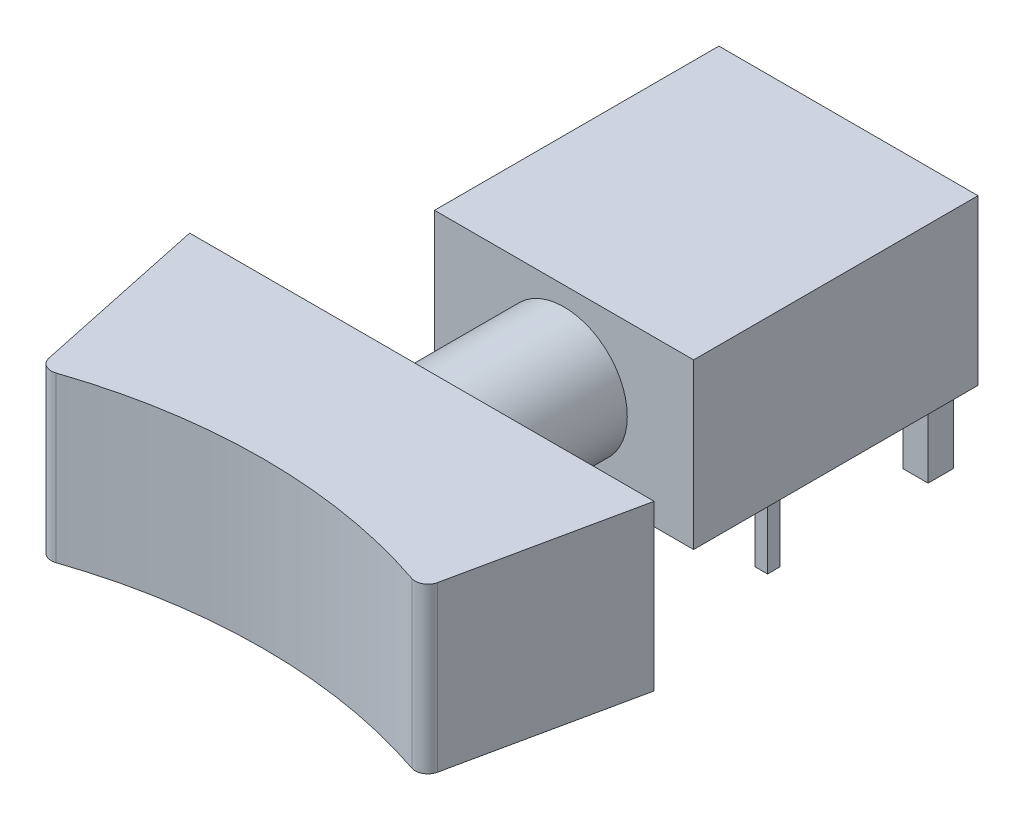
from build123d import *

# Parameters (mm, degrees)
SKETCH1_W           = 8.2
SKETCH1_H           = 9
BOSS_EXTRUDE1_DEPTH = 5.2
SKETCH2_W           = 0.4
SKETCH2_H           = 0.4
SKETCH2_W_2         = 0.8
SKETCH2_H_2         = 0.8
BOSS_EXTRUDE2_DEPTH = 3.3
CHAMFER1_SIZE       = 0.1
CHAMFER2_SIZE       = 0.25
SKETCH2_2_W         = 0.8
SKETCH2_2_H         = 0.38
BOSS_EXTRUDE3_DEPTH = 3
FILLET1_R           = 0.3
SKETCH3_R           = 2
BOSS_EXTRUDE4_DEPTH = 4.5
SKETCH4_W           = 14.7
SKETCH4_H           = 5.2
BOSS_EXTRUDE5_DEPTH = 6.1
CUT_EXTRUDE1_DEPTH  = 19.822393578
FILLET2_R           = 0.4


with BuildPart() as part:
    # Sketch1 → Boss-Extrude1 (new body)
    with BuildSketch(Plane(origin=(0, 0, 0), x_dir=(1, 0, 0), z_dir=(0, 1, 0))):
        Rectangle(SKETCH1_W, SKETCH1_H)
    extrude(amount=BOSS_EXTRUDE1_DEPTH)

    # Sketch2 → Boss-Extrude2 (add)
    with BuildSketch(Plane.XZ):
        with Locations((-2.54, 0.6)):
            Rectangle(SKETCH2_W, SKETCH2_H)
        with Locations((2.54, 0.6)):
            Rectangle(SKETCH2_W, SKETCH2_H)
        with Locations((-2.54, -4.48)):
            Rectangle(SKETCH2_W_2, SKETCH2_H_2)
        with Locations((0, -4.48)):
            Rectangle(SKETCH2_W_2, SKETCH2_H_2)
        with Locations((2.54, -4.48)):
            Rectangle(SKETCH2_W_2, SKETCH2_H_2)
    extrude(amount=BOSS_EXTRUDE2_DEPTH)

    # Chamfer1
    chamfer1_edges = [part.edges().sort_by_distance(p)[0] for p in [
        (-2.34, -3.3, 0.6),
        (-2.54, -3.3, 0.8),
        (-2.74, -3.3, 0.6),
        (-2.54, -3.3, 0.4),
        (2.74, -3.3, 0.6),
        (2.54, -3.3, 0.8),
        (2.34, -3.3, 0.6),
        (2.54, -3.3, 0.4),
    ]]
    chamfer(chamfer1_edges, length=CHAMFER1_SIZE)

    # Chamfer2
    chamfer2_edges = [part.edges().sort_by_distance(p)[0] for p in [
        (-2.14, -3.3, -4.48),
        (-2.54, -3.3, -4.08),
        (-2.94, -3.3, -4.48),
        (-2.54, -3.3, -4.88),
        (0.4, -3.3, -4.48),
        (0, -3.3, -4.08),
        (-0.4, -3.3, -4.48),
        (0, -3.3, -4.88),
        (2.94, -3.3, -4.48),
        (2.54, -3.3, -4.08),
        (2.14, -3.3, -4.48),
        (2.54, -3.3, -4.88),
    ]]
    chamfer(chamfer2_edges, length=CHAMFER2_SIZE)

    # Sketch2<2> → Boss-Extrude3 (add)
    with BuildSketch(Plane.XZ):
        with Locations((-2.54, -4.69)):
            Rectangle(SKETCH2_2_W, SKETCH2_2_H)
        with Locations((0, -4.69)):
            Rectangle(SKETCH2_2_W, SKETCH2_2_H)
        with Locations((2.54, -4.69)):
            Rectangle(SKETCH2_2_W, SKETCH2_2_H)
    extrude(amount=-BOSS_EXTRUDE3_DEPTH)

    # Fillet1
    fillet1_edges = [part.edges().sort_by_distance(p)[0] for p in [
        (-2.54, 3, -4.88),
        (0, 3, -4.88),
        (2.54, 3, -4.88),
    ]]
    fillet(fillet1_edges, radius=FILLET1_R)

    # Sketch3 → Boss-Extrude4 (add)
    with BuildSketch(Plane.XY.offset(4.5)):
        with Locations((0, 2.6)):
            Circle(SKETCH3_R)
    extrude(amount=BOSS_EXTRUDE4_DEPTH)

    # Sketch4 → Boss-Extrude5 (add)
    with BuildSketch(Plane.XY.offset(9)):
        with Locations((0, 2.6)):
            Rectangle(SKETCH4_W, SKETCH4_H)
    extrude(amount=BOSS_EXTRUDE5_DEPTH)

    # Sketch5 → Cut-Extrude1 (cut, through all)
    with BuildSketch(Plane(origin=(0, 5.2, 0), x_dir=(1, 0, 0), z_dir=(0, 1, 0))):
        Polygon((-6.056784937, -15.1), (-7.35, -9), (-7.35, -15.1), align=None)
        with BuildLine():
            ThreePointArc((6.056784937, -15.1), (0, -14.020611804), (-6.056784937, -15.1))
            Line((-6.056784937, -15.1), (6.056784937, -15.1))
        make_face()
        Polygon((7.35, -9), (6.056784937, -15.1), (7.35, -15.1), align=None)
    extrude(amount=-CUT_EXTRUDE1_DEPTH, mode=Mode.SUBTRACT)

    # Fillet2
    fillet2_edges = [part.edges().sort_by_distance(p)[0] for p in [
        (6.056784937, 2.6, 15.1),
        (-6.056784937, 2.6, 15.1),
    ]]
    fillet(fillet2_edges, radius=FILLET2_R)


solid = part.part
